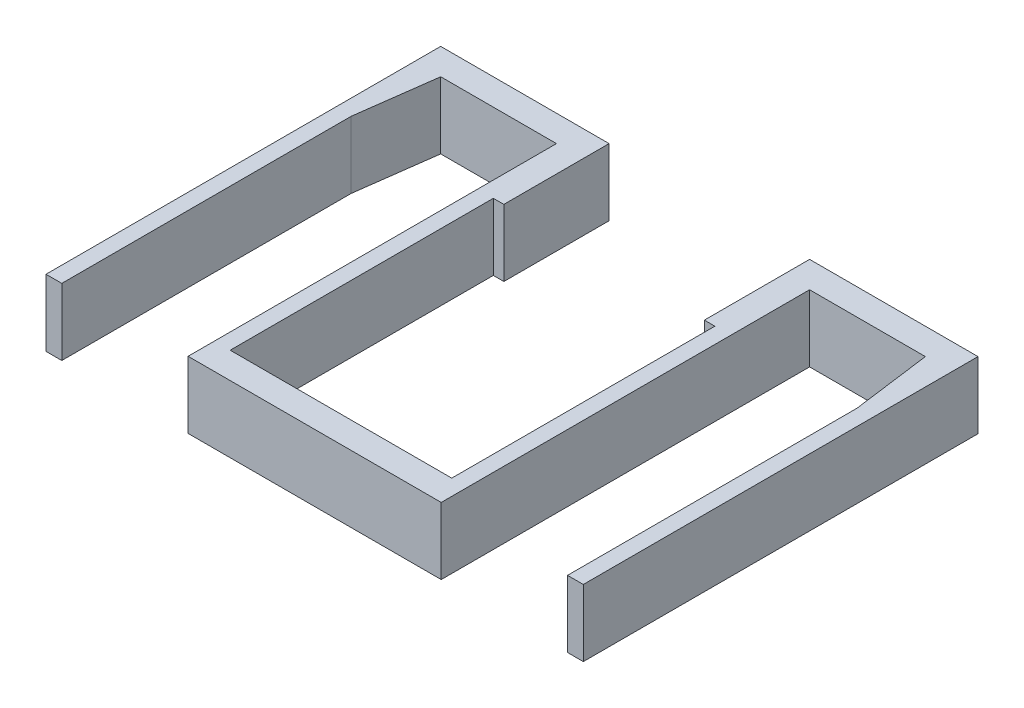
from build123d import *

# Parameters (mm, degrees)
BOSS_EXTRUDE1_DEPTH = 12.7


with BuildPart() as part:
    # Sketch1 → Boss-Extrude1 (new, symmetric)
    with BuildSketch(Plane(origin=(0, 0, 0), x_dir=(1, 0, 0), z_dir=(0, 1, 0))):
        Polygon((-92.1, 130), (-96.1, 100), (-96.1, -10), (-102.1, -10), (-102.1, 140), (-38.1, 140), (-38.1, 100), (-42.1, 100), (-42.1, 0), (42.1, 0), (42.1, 100), (38.1, 100), (38.1, 140), (102.1, 140), (102.1, -10), (96.1, -10), (96.1, 100), (92.1, 130), (48.1, 130), (48.1, -10), (-48.1, -10), (-48.1, 130), align=None)
    extrude(amount=BOSS_EXTRUDE1_DEPTH, both=True)


solid = part.part
